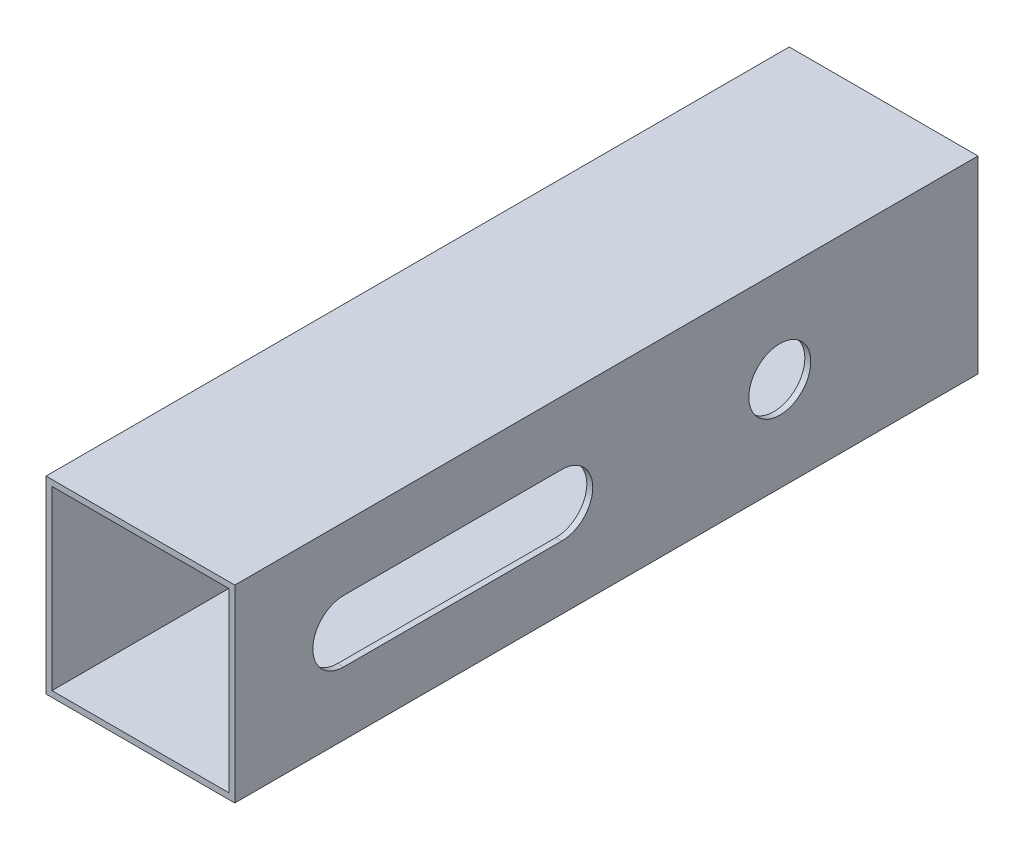
from build123d import *

# Parameters (mm, degrees)
CROQUIS1_W              = 38.1
CROQUIS1_H              = 38.1
SALIENTE_EXTRUIR1_DEPTH = 150
CROQUIS4_W              = 35.7
CROQUIS4_H              = 35.7
CORTAR_EXTRUIR3_DEPTH   = 300
CROQUIS2_R              = 6.25
CORTAR_EXTRUIR5_DEPTH   = 10


with BuildPart() as part:
    # Croquis1 → Saliente-Extruir1 (new body)
    with BuildSketch(Plane.XY):
        Rectangle(CROQUIS1_W, CROQUIS1_H)
    extrude(amount=SALIENTE_EXTRUIR1_DEPTH)

    # Croquis4 → Cortar-Extruir3 (cut)
    with BuildSketch(Plane(origin=(0, 0, 0), x_dir=(-1, 0, 0), z_dir=(0, 0, -1))):
        Rectangle(CROQUIS4_W, CROQUIS4_H)
    extrude(amount=-CORTAR_EXTRUIR3_DEPTH, mode=Mode.SUBTRACT)

    # Croquis2 → Cortar-Extruir5 (cut)
    with BuildSketch(Plane(origin=(19.05, 0, 0), x_dir=(0, 0, -1), z_dir=(1, 0, 0))):
        with Locations(Location((-40, 0, 0), (0, 0, 90))):
            Circle(CROQUIS2_R)
        with BuildLine():
            Line((-128, -6.25), (-84, -6.25))
            ThreePointArc((-84, -6.25), (-77.75, 0), (-84, 6.25))
            Line((-84, 6.25), (-128, 6.25))
            ThreePointArc((-128, 6.25), (-134.25, 0), (-128, -6.25))
        make_face()
    extrude(amount=-CORTAR_EXTRUIR5_DEPTH, mode=Mode.SUBTRACT)


solid = part.part
